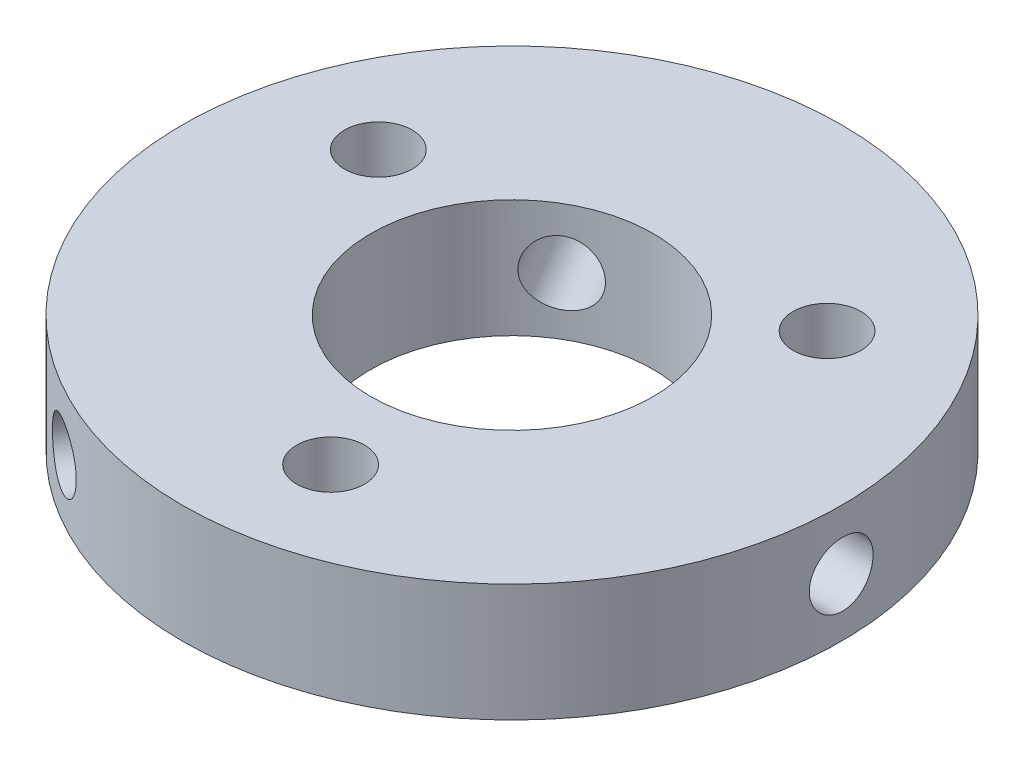
from build123d import *

# Parameters (mm, degrees)
SKETCH1_R                                      = 17.78
BOSS_EXTRUDE1_DEPTH                            = 6.35
CIRPATTERN3_COUNT                              = 3
CUT_EXTRUDE2_REACH                             = 27.934
SKETCH16_R                                     = 7.62
CBORE_FOR_6_SOCKET_HEAD_CAP_SCREW4_D           = 3.6576
CBORE_FOR_6_SOCKET_HEAD_CAP_SCREW4_CBORE_D     = 7.14502
CBORE_FOR_6_SOCKET_HEAD_CAP_SCREW4_CBORE_DEPTH = 3.5052
CIRPATTERN4_COUNT                              = 3


with BuildPart() as part:
    # Sketch1 → Boss-Extrude1 (new body)
    with BuildSketch(Plane(origin=(0, 0, 0), x_dir=(1, 0, 0), z_dir=(0, 1, 0))):
        with Locations(Location((0, 0, 0), (0, 0, 270))):
            Circle(SKETCH1_R)
    extrude(amount=BOSS_EXTRUDE1_DEPTH)

    # Sketch15 → Tap Drill for #8-32 Tap2 (revolve, cut)
    with BuildSketch(Plane(origin=(-8.835910942, 3.105629072, 15.4290336), x_dir=(0.8677746681735182, 0, 0.4969578707258196), z_dir=(0, 1, 0))):
        Polygon((0, 0), (0, 14.149292883), (1.7272, 12.7), (1.7272, 0), align=None)
    tap_drill_for_8_32_tap2 = revolve(axis=Axis((-11.991593421, 3.105629072, 20.939402743), (0.4969578707258196, 0, -0.8677746681735182)), mode=Mode.SUBTRACT)

    # CirPattern3: Tap Drill for #8-32 Tap2 ×3 about axis
    cirpattern3_axis = Axis((0, 6.35, 0), (0, -1, 0))
    for i in range(1, CIRPATTERN3_COUNT):
        add(tap_drill_for_8_32_tap2.rotate(cirpattern3_axis, i * 360 / CIRPATTERN3_COUNT), mode=Mode.SUBTRACT)

    # Sketch16 → Cut-Extrude2 (cut, up to next)
    with BuildSketch(Plane(origin=(0, 6.35, 0), x_dir=(1, 0, 0), z_dir=(0, 1, 0)), mode=Mode.PRIVATE) as cut_extrude2_sk1:
        with Locations(Location((0, 0, 0), (0, 0, 270))):
            Circle(SKETCH16_R)
    cut_extrude2_tool1 = extrude(cut_extrude2_sk1.sketch, amount=-CUT_EXTRUDE2_REACH, mode=Mode.PRIVATE) & part.part
    add(cut_extrude2_tool1.solids().sort_by_distance((0, 6.35, 0))[0], mode=Mode.SUBTRACT)

    # CBORE for #6 Socket Head Cap Screw4 (through all)
    with Locations(Plane(origin=(9.242326206, 0, -7.755232511), x_dir=(0, 0, -1), z_dir=(0, -1, 0))):
        with Locations((0, 0)):
            cbore_for_6_socket_head_cap_screw4 = CounterBoreHole(CBORE_FOR_6_SOCKET_HEAD_CAP_SCREW4_D / 2, CBORE_FOR_6_SOCKET_HEAD_CAP_SCREW4_CBORE_D / 2, CBORE_FOR_6_SOCKET_HEAD_CAP_SCREW4_CBORE_DEPTH)

    # CirPattern4: CBORE for #6 Socket Head Cap Screw4 ×3 about axis
    cirpattern4_axis = Axis((0, 0, 0), (0, 1, 0))
    for i in range(1, CIRPATTERN4_COUNT):
        add(cbore_for_6_socket_head_cap_screw4.rotate(cirpattern4_axis, i * 360 / CIRPATTERN4_COUNT), mode=Mode.SUBTRACT)


solid = part.part
